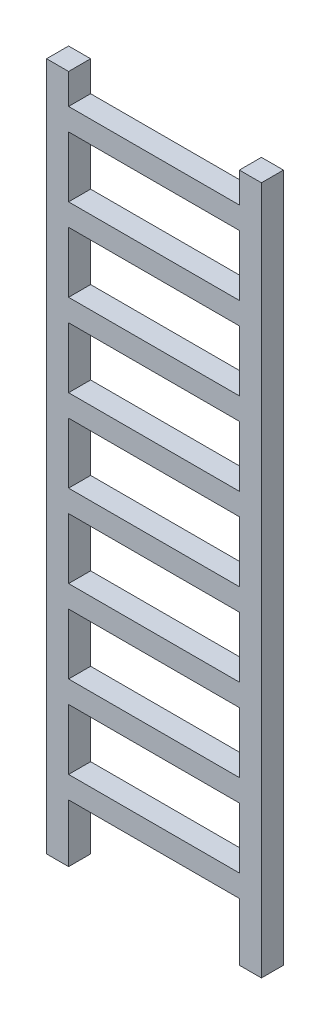
from build123d import *

# Parameters (mm, degrees)
SKETCH_1_W       = 80
SKETCH_1_H       = 2500
EXTRUDE_1_DEPTH  = 80
SKETCH_2_W       = 80
SKETCH_2_H       = 2500
EXTRUDE_2_DEPTH  = 80
SKETCH_3_W       = 700
SKETCH_3_H       = 80
EXTRUDE_3_DEPTH  = 80
SKETCH_4_W       = 700
SKETCH_4_H       = 80
EXTRUDE_4_DEPTH  = 80
SKETCH_5_W       = 700
SKETCH_5_H       = 80
EXTRUDE_5_DEPTH  = 80
SKETCH_6_W       = 700
SKETCH_6_H       = 80
EXTRUDE_6_DEPTH  = 80
SKETCH_7_W       = 700
SKETCH_7_H       = 80
EXTRUDE_7_DEPTH  = 80
SKETCH_8_W       = 700
SKETCH_8_H       = 80
EXTRUDE_8_DEPTH  = 80
SKETCH_9_W       = 700
SKETCH_9_H       = 80
EXTRUDE_9_DEPTH  = 80
SKETCH_10_W      = 700
SKETCH_10_H      = 80
EXTRUDE_10_DEPTH = 80


with BuildPart() as part:
    # 草图1 → 凸台-拉伸1 (new body)
    with BuildSketch(Plane.XY):
        with Locations((-350, 0)):
            Rectangle(SKETCH_1_W, SKETCH_1_H)
    extrude(amount=EXTRUDE_1_DEPTH)



with BuildPart() as body_2:
    # 草图2 → 凸台-拉伸2 (new body)
    with BuildSketch(Plane.XY):
        with Locations((350, 0)):
            Rectangle(SKETCH_2_W, SKETCH_2_H)
    extrude(amount=EXTRUDE_2_DEPTH)


with BuildPart() as part_1:
    add(part.part)

    add(body_2.part)  # 凸台-拉伸3 merges body 2
    # 草图3 → 凸台-拉伸3 (add)
    with BuildSketch(Plane.XY):
        with Locations((0, 1100)):
            Rectangle(SKETCH_3_W, SKETCH_3_H)
    extrude(amount=EXTRUDE_3_DEPTH)

    # 草图4 → 凸台-拉伸4 (add)
    with BuildSketch(Plane.XY):
        with Locations((0, 800)):
            Rectangle(SKETCH_4_W, SKETCH_4_H)
    extrude(amount=EXTRUDE_4_DEPTH)

    # 草图5 → 凸台-拉伸5 (add)
    with BuildSketch(Plane.XY):
        with Locations((0, 500)):
            Rectangle(SKETCH_5_W, SKETCH_5_H)
    extrude(amount=EXTRUDE_5_DEPTH)

    # 草图6 → 凸台-拉伸6 (add)
    with BuildSketch(Plane.XY):
        with Locations((0, 200)):
            Rectangle(SKETCH_6_W, SKETCH_6_H)
    extrude(amount=EXTRUDE_6_DEPTH)

    # 草图7 → 凸台-拉伸7 (add)
    with BuildSketch(Plane.XY):
        with Locations((0, -100)):
            Rectangle(SKETCH_7_W, SKETCH_7_H)
    extrude(amount=EXTRUDE_7_DEPTH)

    # 草图8 → 凸台-拉伸8 (add)
    with BuildSketch(Plane.XY):
        with Locations((0, -400)):
            Rectangle(SKETCH_8_W, SKETCH_8_H)
    extrude(amount=EXTRUDE_8_DEPTH)

    # 草图9 → 凸台-拉伸9 (add)
    with BuildSketch(Plane.XY):
        with Locations((0, -700)):
            Rectangle(SKETCH_9_W, SKETCH_9_H)
    extrude(amount=EXTRUDE_9_DEPTH)

    # 草图10 → 凸台-拉伸10 (add)
    with BuildSketch(Plane.XY):
        with Locations((0, -1000)):
            Rectangle(SKETCH_10_W, SKETCH_10_H)
    extrude(amount=EXTRUDE_10_DEPTH)


solid = part_1.part
